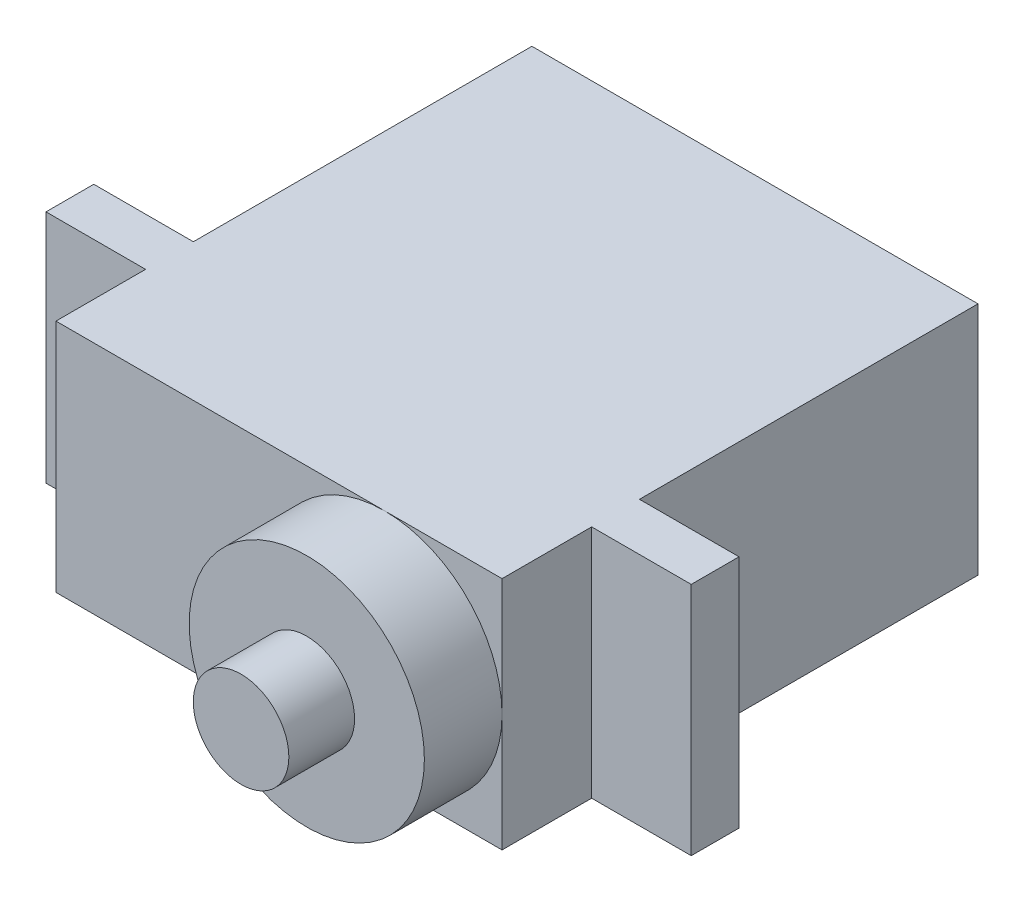
from build123d import *

# Parameters (mm, degrees)
CROQUIS1_W              = 11.8
CROQUIS1_H              = 32.4
SALIENTE_EXTRUIR1_DEPTH = 2.4
CROQUIS2_W              = 22.4
CROQUIS2_H              = 11.8
SALIENTE_EXTRUIR2_DEPTH = 4.5
CROQUIS3_R              = 5.905235569
SALIENTE_EXTRUIR3_DEPTH = 3.9
CROQUIS4_R              = 2.4
SALIENTE_EXTRUIR4_DEPTH = 3.3
CROQUIS5_W              = 22.4
CROQUIS5_H              = 11.8
SALIENTE_EXTRUIR5_DEPTH = 17


with BuildPart() as part:
    # Croquis1 → Saliente-Extruir1 (new body)
    with BuildSketch(Plane(origin=(0, 0, 0), x_dir=(0, 1, 0), z_dir=(0, 0, 1))):
        Rectangle(CROQUIS1_W, CROQUIS1_H)
    extrude(amount=SALIENTE_EXTRUIR1_DEPTH)

    # Croquis2 → Saliente-Extruir2 (add)
    with BuildSketch(Plane.XY.offset(2.4)):
        Rectangle(CROQUIS2_W, CROQUIS2_H)
    extrude(amount=SALIENTE_EXTRUIR2_DEPTH)

    # Croquis3 → Saliente-Extruir3 (add)
    with BuildSketch(Plane.XY.offset(6.9)):
        with Locations((5.294766752, -0.005235569)):
            Circle(CROQUIS3_R)
    extrude(amount=SALIENTE_EXTRUIR3_DEPTH)

    # Croquis4 → Saliente-Extruir4 (add)
    with BuildSketch(Plane.XY.offset(10.8)):
        with Locations((5.294766752, -0.005235569)):
            Circle(CROQUIS4_R)
    extrude(amount=SALIENTE_EXTRUIR4_DEPTH)

    # Croquis5 → Saliente-Extruir5 (add)
    with BuildSketch(Plane(origin=(0, 0, 0), x_dir=(1, 0, 0), z_dir=(0, 0, -1))):
        Rectangle(CROQUIS5_W, CROQUIS5_H)
    extrude(amount=SALIENTE_EXTRUIR5_DEPTH)


solid = part.part
